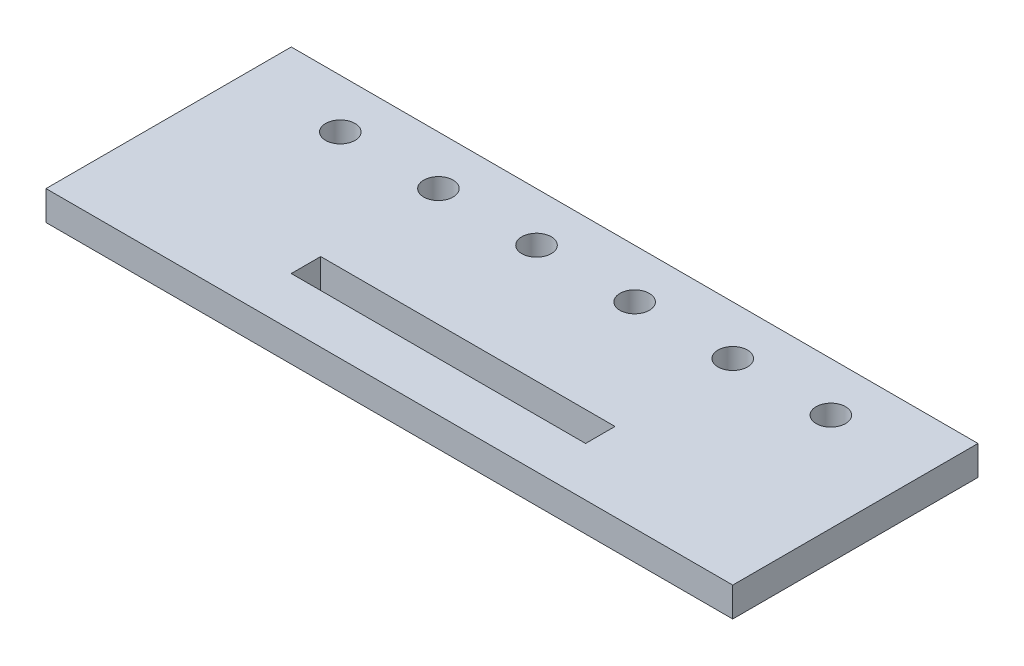
from build123d import *

# Parameters (mm, degrees)
SKETCH1_W           = 70
SKETCH1_H           = 25
SKETCH1_R           = 1.5
SKETCH1_W_2         = 30
SKETCH1_H_2         = 3
BOSS_EXTRUDE1_DEPTH = 3


with BuildPart() as part:
    # Sketch1 → Boss-Extrude1 (new body)
    with BuildSketch(Plane(origin=(0, 0, 0), x_dir=(1, 0, 0), z_dir=(0, 1, 0))):
        Rectangle(SKETCH1_W, SKETCH1_H)
        with Locations(Location((-25, 7.5, 0), (0, 0, 270))):
            Circle(SKETCH1_R, mode=Mode.SUBTRACT)
        with Locations(Location((-15, 7.5, 0), (0, 0, 270))):
            Circle(SKETCH1_R, mode=Mode.SUBTRACT)
        with Locations(Location((-5, 7.5, 0), (0, 0, 270))):
            Circle(SKETCH1_R, mode=Mode.SUBTRACT)
        with Locations(Location((5, 7.5, 0), (0, 0, 270))):
            Circle(SKETCH1_R, mode=Mode.SUBTRACT)
        with Locations(Location((15, 7.5, 0), (0, 0, 270))):
            Circle(SKETCH1_R, mode=Mode.SUBTRACT)
        with Locations(Location((25, 7.5, 0), (0, 0, 270))):
            Circle(SKETCH1_R, mode=Mode.SUBTRACT)
        with Locations((0, -6)):
            Rectangle(SKETCH1_W_2, SKETCH1_H_2, mode=Mode.SUBTRACT)
    extrude(amount=BOSS_EXTRUDE1_DEPTH)


solid = part.part
